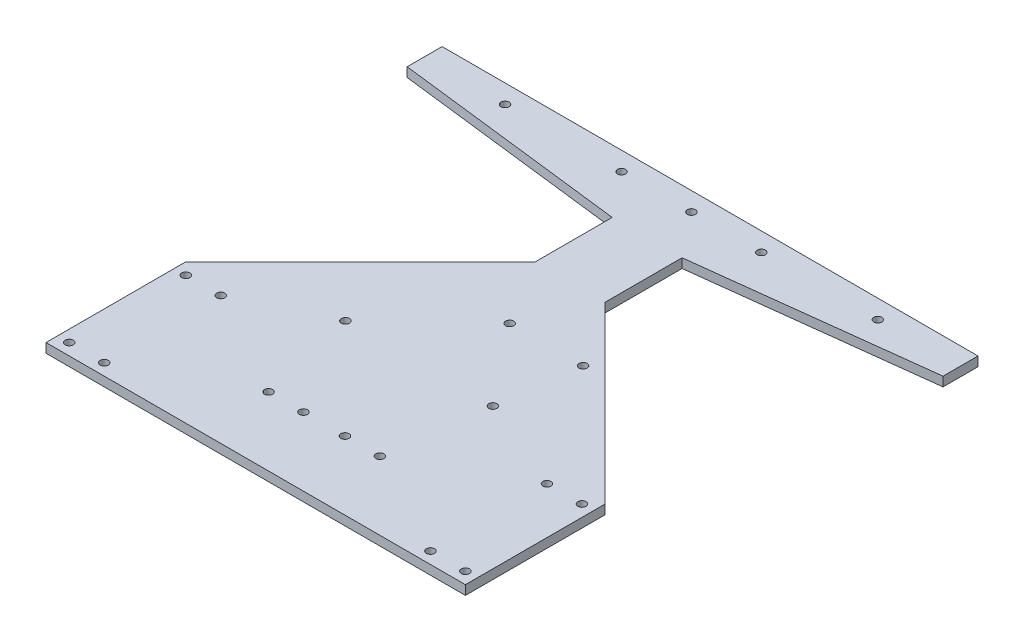
from build123d import *

# Parameters (mm, degrees)
BOSS_EXTRUDE1_DEPTH = 4
SKETCH2_R           = 1.75
CUT_EXTRUDE1_DEPTH  = 202.161626559
SKETCH3_R           = 1.75
CUT_EXTRUDE2_DEPTH  = 202.161626559
SKETCH4_R           = 1.75
CUT_EXTRUDE3_DEPTH  = 202.161626559
SKETCH5_R           = 1.75
CUT_EXTRUDE4_DEPTH  = 202.161626559


with BuildPart() as part:
    # Sketch1 → Boss-Extrude1 (new body)
    with BuildSketch(Plane(origin=(0, 0, 0), x_dir=(1, 0, 0), z_dir=(0, 1, 0))):
        Polygon((-90, 30), (-15, 105), (-15, 138), (-115, 150), (-115, 165), (115, 165), (115, 150), (15, 138), (15, 105), (90, 30), (90, -30), (-90, -30), align=None)
    extrude(amount=BOSS_EXTRUDE1_DEPTH)

    # Sketch2 → Cut-Extrude1 (cut, through all)
    with BuildSketch(Plane(origin=(0, 4, 0), x_dir=(1, 0, 0), z_dir=(0, 1, 0))):
        with Locations(Location((-85, 25, 0), (0, 0, 270))):
            Circle(SKETCH2_R)
        with Locations(Location((85, 25, 0), (0, 0, 90))):
            Circle(SKETCH2_R)
        with Locations(Location((85, -25, 0), (0, 0, 270))):
            Circle(SKETCH2_R)
        with Locations(Location((-85, -25, 0), (0, 0, 90))):
            Circle(SKETCH2_R)
        with Locations(Location((-70, 25, 0), (0, 0, 270))):
            Circle(SKETCH2_R)
        with Locations(Location((-70, -25, 0), (0, 0, 90))):
            Circle(SKETCH2_R)
        with Locations(Location((70, -25, 0), (0, 0, 270))):
            Circle(SKETCH2_R)
        with Locations(Location((70, 25, 0), (0, 0, 90))):
            Circle(SKETCH2_R)
    extrude(amount=-CUT_EXTRUDE1_DEPTH, mode=Mode.SUBTRACT)

    # Sketch3 → Cut-Extrude2 (cut, through all)
    with BuildSketch(Plane(origin=(0, 4, 0), x_dir=(1, 0, 0), z_dir=(0, 1, 0))):
        with Locations(Location((2.4, 76.6, 0), (0, 0, 270))):
            Circle(SKETCH3_R)
        with Locations(Location((-33.8, 42.3, 0), (0, 0, 270))):
            Circle(SKETCH3_R)
        with Locations(Location((33.9, 76.6, 0), (0, 0, 270))):
            Circle(SKETCH3_R)
        with Locations(Location((29.5, 42.3, 0), (0, 0, 270))):
            Circle(SKETCH3_R)
    extrude(amount=-CUT_EXTRUDE2_DEPTH, mode=Mode.SUBTRACT)

    # Sketch4 → Cut-Extrude3 (cut, through all)
    with BuildSketch(Plane(origin=(0, 4, 0), x_dir=(1, 0, 0), z_dir=(0, 1, 0))):
        with Locations(Location((-23.9, -0.6, 0), (0, 0, 270))):
            Circle(SKETCH4_R)
        with Locations(Location((-8.9, -0.6, 0), (0, 0, 270))):
            Circle(SKETCH4_R)
        with Locations(Location((8.9, -0.6, 0), (0, 0, 270))):
            Circle(SKETCH4_R)
        with Locations(Location((23.9, -0.6, 0), (0, 0, 270))):
            Circle(SKETCH4_R)
    extrude(amount=-CUT_EXTRUDE3_DEPTH, mode=Mode.SUBTRACT)

    # Sketch5 → Cut-Extrude4 (cut, through all)
    with BuildSketch(Plane(origin=(0, 4, 0), x_dir=(1, 0, 0), z_dir=(0, 1, 0))):
        with Locations(Location((0, 157, 0), (0, 0, 270))):
            Circle(SKETCH5_R)
        with Locations(Location((-30, 157, 0), (0, 0, 270))):
            Circle(SKETCH5_R)
        with Locations(Location((30, 157, 0), (0, 0, 270))):
            Circle(SKETCH5_R)
        with Locations(Location((80, 157, 0), (0, 0, 270))):
            Circle(SKETCH5_R)
        with Locations(Location((-80, 157, 0), (0, 0, 270))):
            Circle(SKETCH5_R)
    extrude(amount=-CUT_EXTRUDE4_DEPTH, mode=Mode.SUBTRACT)


solid = part.part
